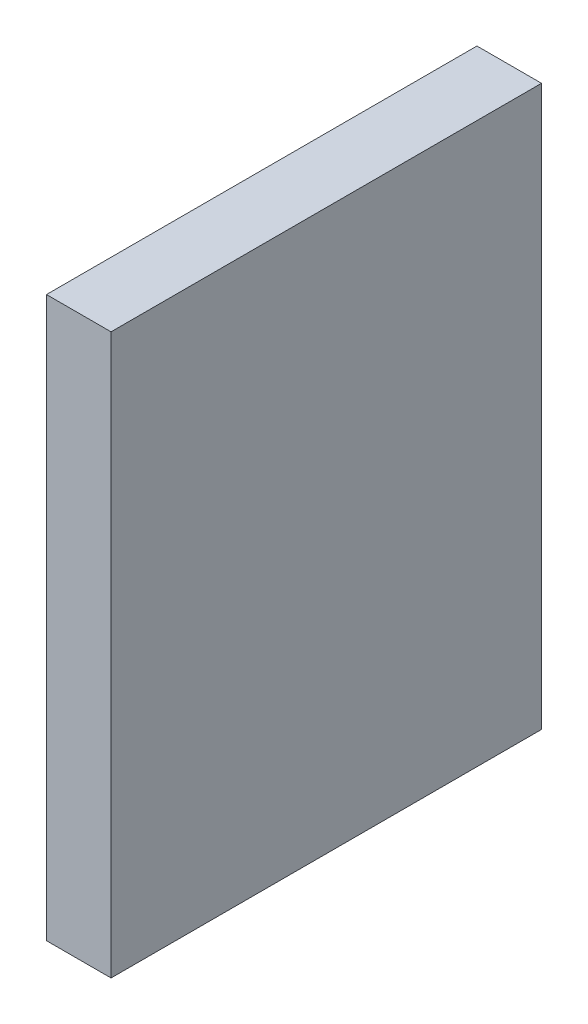
from build123d import *

# Parameters (mm, degrees)
ESQUISSE1_W        = 15
ESQUISSE1_H        = 100
BOSS_EXTRU_1_DEPTH = 130


with BuildPart() as part:
    # Esquisse1 → Boss.-Extru.1 (new body)
    with BuildSketch(Plane(origin=(0, 0, 0), x_dir=(1, 0, 0), z_dir=(0, 1, 0))):
        with Locations((-46.957335586, 37.165315651)):
            Rectangle(ESQUISSE1_W, ESQUISSE1_H)
    extrude(amount=BOSS_EXTRU_1_DEPTH)


solid = part.part
